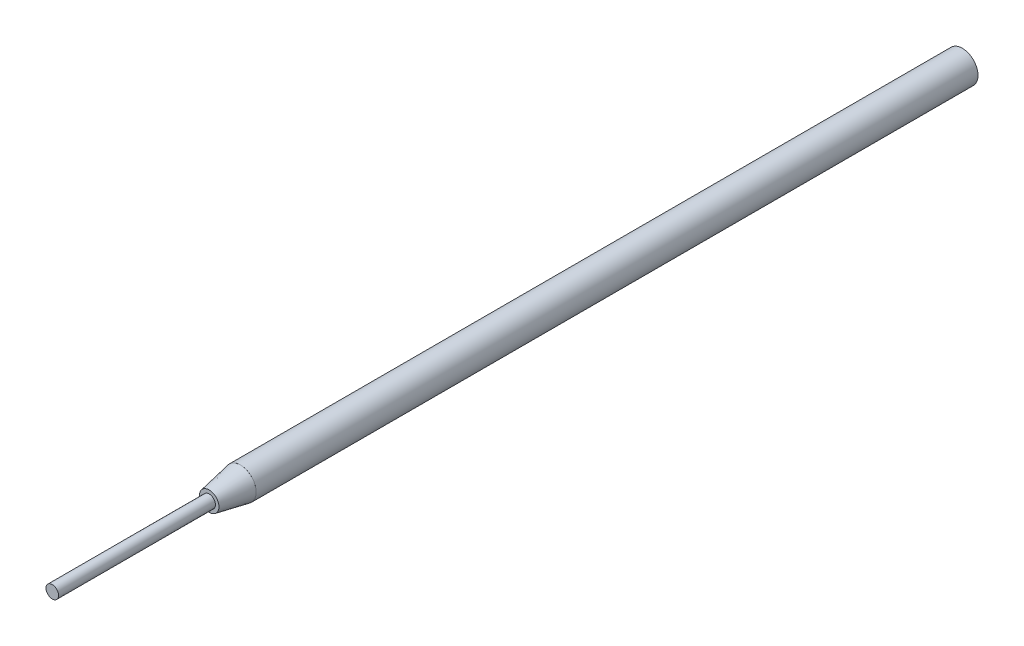
from build123d import *

# Parameters (mm, degrees)
SKETCH1_R           = 2.5
BOSS_EXTRUDE1_DEPTH = 115
SKETCH4_R           = 1
BOSS_EXTRUDE2_DEPTH = 25


with BuildPart() as part:
    # Sketch1 → Boss-Extrude1 (new body)
    with BuildSketch(Plane.XY):
        Circle(SKETCH1_R)
    extrude(amount=BOSS_EXTRUDE1_DEPTH)


with BuildPart() as body_2:
    # Sketch2 → Revolve1 (revolve)
    with BuildSketch(Plane(origin=(0, 0, 0), x_dir=(1, 0, 0), z_dir=(0, 1, 0))):
        Polygon((-1.947112733, -115.007064782), (-1, -119.98622168), (-1.552887267, -119.98622168), (-2.5, -115.007064782), align=None)
    revolve(axis=Axis((0, 0, 0), (0, 0, 1)))


with BuildPart() as body_3:
    # Sketch4 → Boss-Extrude2 (new body)
    with BuildSketch(Plane.XY.offset(119.98622168)):
        Circle(SKETCH4_R)
    extrude(amount=BOSS_EXTRUDE2_DEPTH)


solid = Compound([part.part, body_2.part, body_3.part])
